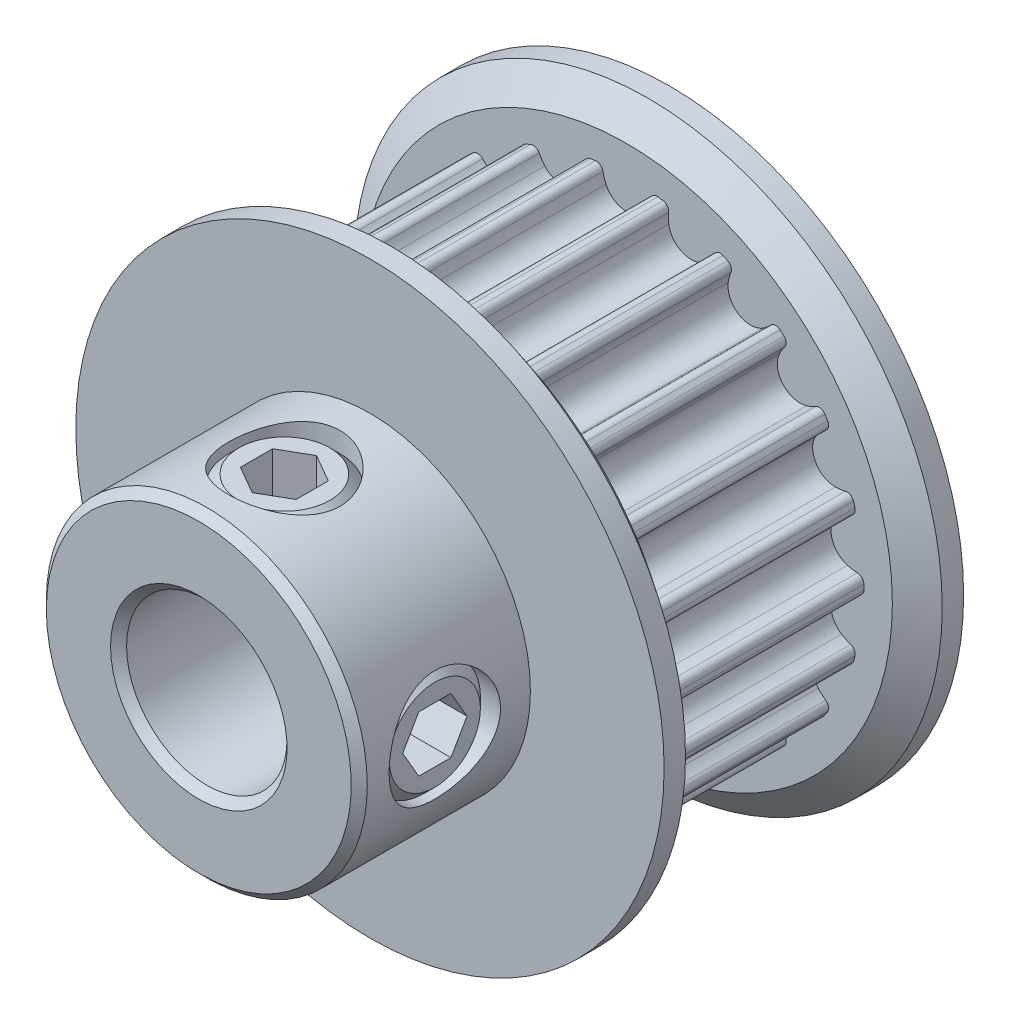
from build123d import *

# Parameters (mm, degrees)
CUT_EXTRUDE1_START = 0.8
CUT_EXTRUDE1_DEPTH = 8
CIRPATTERN1_COUNT  = 22
SKETCH4_R          = 2.0828
CUT_EXTRUDE2_DEPTH = 18.87288449
CUT_EXTRUDE3_DEPTH = 1.5621
CIRPATTERN2_COUNT  = 2
CIRPATTERN2_ANGLE  = 90
CHAMFER1_SIZE      = 0.3


with BuildPart() as part:
    # Sketch2 → Revolve1 (revolve)
    with BuildSketch(Plane(origin=(0, 0, 0), x_dir=(0, 0, -1), z_dir=(1, 0, 0)), mode=Mode.PRIVATE) as revolve1_sk:
        Polygon((-8.8, 3), (8.8, 3), (8.8, 11), (8, 11), (7.2, 9.9345), (7.2, 8.869), (-0.8, 8.869), (-0.8, 9.9345), (-1.6, 11), (-2.4, 11), (-2.4, 6), (-8.8, 6), align=None)
    revolve(revolve1_sk.sketch.rotate(Axis((0, 0, 8.8), (0, 0, -1)), 90), axis=Axis((0, 0, 8.8), (0, 0, -1)))

    # Sketch3 → Cut-Extrude1 (cut)
    with BuildSketch(Plane.XY.offset(CUT_EXTRUDE1_START)):
        with BuildLine():
            Line((3.715771761, 11), (-3.715771761, 11))
            Line((-3.715771761, 11), (-2.838360325, 8.402551497))
            ThreePointArc((-2.838360325, 8.402551497), (-2.011214575, 8.637949811), (-1.165158643, 8.792130933))
            ThreePointArc((-1.165158643, 8.792130933), (-0.984832853, 8.746161529), (-0.88622537, 8.588341566))
            ThreePointArc((-0.88622537, 8.588341566), (-0.841316221, 8.404374626), (-0.773880597, 8.227419538))
            ThreePointArc((-0.773880597, 8.227419538), (0, 7.729), (0.773880597, 8.227419538))
            ThreePointArc((0.773880597, 8.227419538), (0.841316221, 8.404374626), (0.88622537, 8.588341566))
            ThreePointArc((0.88622537, 8.588341566), (0.984832853, 8.746161529), (1.165158643, 8.792130933))
            ThreePointArc((1.165158643, 8.792130933), (2.011214575, 8.637949811), (2.838360325, 8.402551497))
            Line((2.838360325, 8.402551497), (3.715771761, 11))
        make_face()
    cut_extrude1 = extrude(amount=-CUT_EXTRUDE1_DEPTH, mode=Mode.SUBTRACT)

    # CirPattern1: Cut-Extrude1 ×22 about axis
    cirpattern1_axis = Axis((0, 0, 0), (0, 0, 1))
    for i in range(1, CIRPATTERN1_COUNT):
        add(cut_extrude1.rotate(cirpattern1_axis, i * 360 / CIRPATTERN1_COUNT), mode=Mode.SUBTRACT)

    # Sketch4 → Cut-Extrude2 (cut, through all)
    with BuildSketch(Plane(origin=(0, 0, 0), x_dir=(0, -1, 0), z_dir=(1, 0, 0))):
        with Locations(Location((0, -5.6, 0), (0, 0, 270))):
            Circle(SKETCH4_R)
    cut_extrude2 = extrude(amount=CUT_EXTRUDE2_DEPTH, mode=Mode.SUBTRACT)

    # Sketch5 → Revolve2 (revolve)
    with BuildSketch(Plane.XY.offset(5.6)):
        Polygon((3, -1.7018), (3, 0), (5.626894717, 0), (5.626894717, -1.7018), (5.245894717, -2.0828), (3.381, -2.0828), align=None)
    revolve2 = revolve(axis=Axis((3, 0, 5.6), (1, 0, 0)))

    # Sketch6 → Cut-Extrude3 (cut)
    with BuildSketch(Plane(origin=(5.626894717, 5.384140679, 0), x_dir=(0, -1, 0), z_dir=(-1, 0, 0))):
        Polygon((5.384140679, 6.802505141), (4.342740679, 6.20125257), (4.342740679, 4.99874743), (5.384140679, 4.397494859), (6.425540679, 4.99874743), (6.425540679, 6.20125257), align=None)
    cut_extrude3 = extrude(amount=CUT_EXTRUDE3_DEPTH, mode=Mode.SUBTRACT)

    # CirPattern2: Cut-Extrude2, Revolve2, Cut-Extrude3 ×2 about axis
    cirpattern2_axis = Axis((0, 0, 0), (0, 0, 1))
    add([cut_extrude2.rotate(cirpattern2_axis, i * CIRPATTERN2_ANGLE / (CIRPATTERN2_COUNT - 1)) for i in range(1, CIRPATTERN2_COUNT)], mode=Mode.SUBTRACT)
    add([revolve2.rotate(cirpattern2_axis, i * CIRPATTERN2_ANGLE / (CIRPATTERN2_COUNT - 1)) for i in range(1, CIRPATTERN2_COUNT)])
    add([cut_extrude3.rotate(cirpattern2_axis, i * CIRPATTERN2_ANGLE / (CIRPATTERN2_COUNT - 1)) for i in range(1, CIRPATTERN2_COUNT)], mode=Mode.SUBTRACT)

    # Chamfer1
    chamfer1_edges = [part.edges().sort_by_distance(p)[0] for p in [
        (-6, 0, 8.8),
        (-3, 0, 8.8),
    ]]
    chamfer(chamfer1_edges, length=CHAMFER1_SIZE)


solid = part.part
